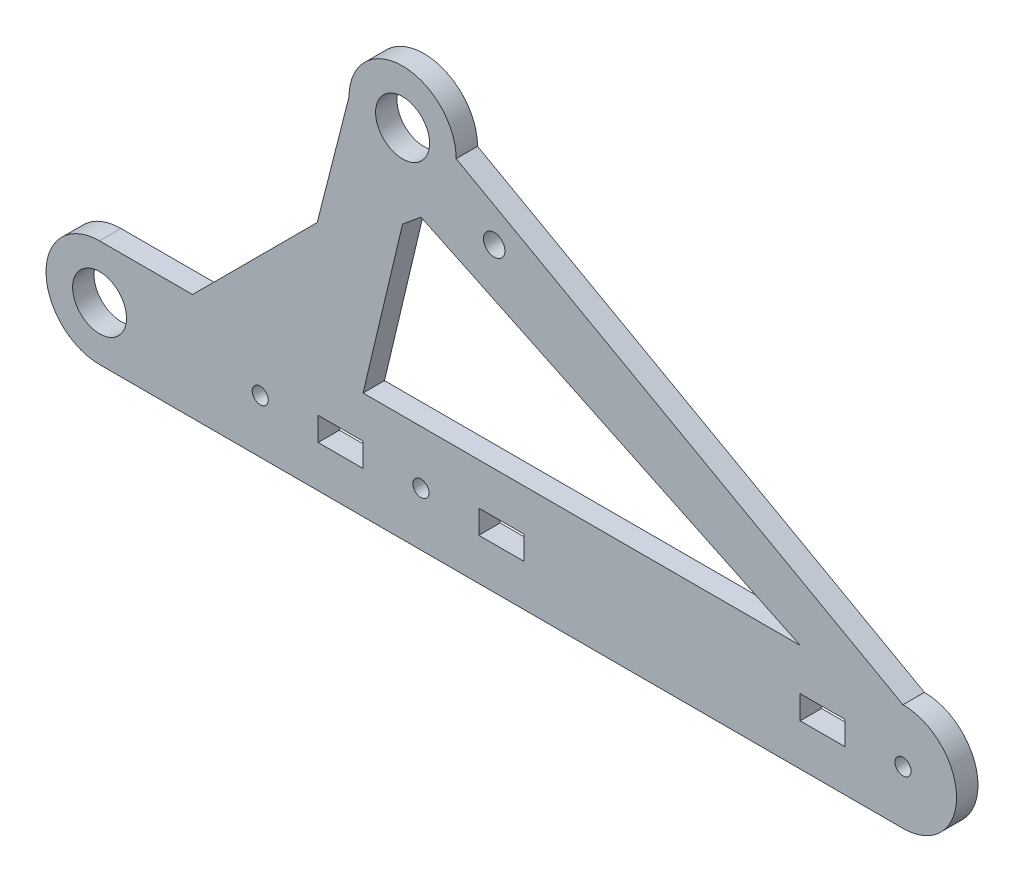
from build123d import *

# Parameters (mm, degrees)
SKETCH_1_R      = 5.03
SKETCH_1_R_2    = 5.04
SKETCH_1_R_3    = 1.5
SKETCH_1_R_4    = 2
SKETCH_1_W      = 8.4
SKETCH_1_H      = 4.4
EXTRUDE_1_DEPTH = 4
EXTRUDE_2_DEPTH = 4


with BuildPart() as part:
    # 草图1 → 凸台-拉伸1 (new body)
    with BuildSketch(Plane.XY):
        with BuildLine():
            Line((0, 10), (34.696699141, 10))
            Line((34.696699141, 10), (46.568305139, 56.568542495))
            ThreePointArc((46.568305139, 56.568542495), (56.568542495, 66.568779851), (66.568779851, 56.568542495))
            Line((66.568779851, 56.568542495), (150, 10))
            ThreePointArc((150, 10), (160, 0), (150, -10))
            Line((150, -10), (0, -10))
            ThreePointArc((0, -10), (-10, 0), (0, 10))
        make_face()
        Circle(SKETCH_1_R, mode=Mode.SUBTRACT)
        with Locations((56.568542495, 56.568542495)):
            Circle(SKETCH_1_R_2, mode=Mode.SUBTRACT)
        with Locations((30, 0)):
            Circle(SKETCH_1_R_3, mode=Mode.SUBTRACT)
        with Locations((60, 0)):
            Circle(SKETCH_1_R_3, mode=Mode.SUBTRACT)
        with Locations((150, 0)):
            Circle(SKETCH_1_R_3, mode=Mode.SUBTRACT)
        with Locations((73.677090033, 46.210086957)):
            Circle(SKETCH_1_R_4, mode=Mode.SUBTRACT)
        with Locations((75, 0)):
            Rectangle(SKETCH_1_W, SKETCH_1_H, mode=Mode.SUBTRACT)
        with Locations((45, 0)):
            Rectangle(SKETCH_1_W, SKETCH_1_H, mode=Mode.SUBTRACT)
        with Locations((135, 0)):
            Rectangle(SKETCH_1_W, SKETCH_1_H, mode=Mode.SUBTRACT)
        Polygon((56.568542495, 40.992584384), (49.2, 10), (130.8, 10), (60, 43.844151412), align=None, mode=Mode.SUBTRACT)
    extrude(amount=EXTRUDE_1_DEPTH)

    # 草图2 → 凸台-拉伸2 (add)
    with BuildSketch(Plane.XY.offset(4)):
        Polygon((34.696699141, 10), (40.63250214, 33.284271247), (17.348349571, 10), align=None)
    extrude(amount=-EXTRUDE_2_DEPTH)


solid = part.part
